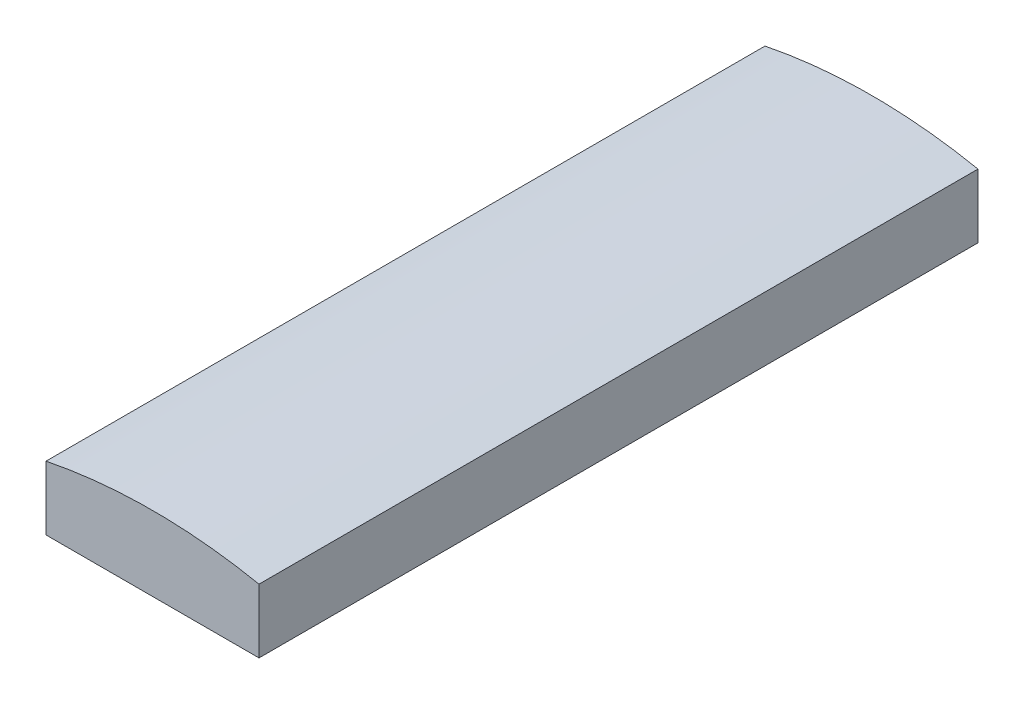
from build123d import *

# Parameters (mm, degrees)
BOSS_EXTRUDE1_DEPTH = 67.5


with BuildPart() as part:
    # Sketch1 → Boss-Extrude1 (new body)
    with BuildSketch(Plane.XY):
        with BuildLine():
            Line((0, 0), (20, 0))
            Line((20, 0), (20, 6))
            ThreePointArc((20, 6), (10, 7), (0, 6))
            Line((0, 6), (0, 0))
        make_face()
    extrude(amount=BOSS_EXTRUDE1_DEPTH)


solid = part.part
